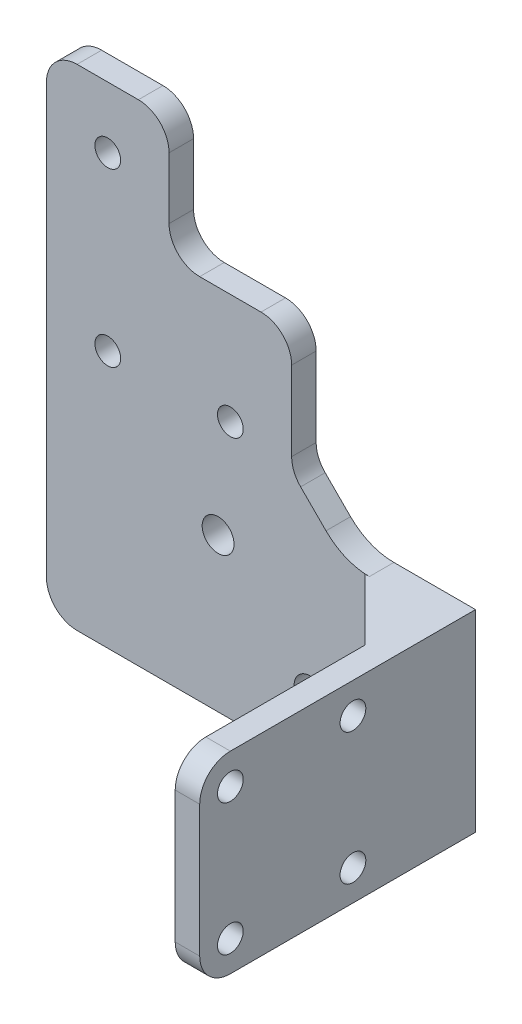
from build123d import *

# Parameters (mm, degrees)
MODEL_R         = 2.5999948
MODEL_R_2       = 2.0999958
EXTRUDE_1_DEPTH = 4
EXTRUDE_2_DEPTH = 4
FILLET_1_R      = 10
SKETCH_4_R      = 2.1
EXTRUDE_3_DEPTH = 4
EXTRUDE_4_DEPTH = 4


with BuildPart() as part:
    # Model → Бобышка-Вытянуть1 (new body)
    with BuildSketch(Plane.XY):
        with BuildLine():
            Line((308.392658055, 233.393719024), (308.392658055, 210.464832693))
            ThreePointArc((308.392658055, 210.464832693), (306.92819489, 206.929305859), (303.392668055, 205.464842693))
            Line((303.392668055, 205.464842693), (263.392748055, 205.464842693))
            ThreePointArc((263.392748055, 205.464842693), (259.85722122, 206.929305859), (258.392758055, 210.464832693))
            Line((258.392758055, 210.464832693), (258.392758055, 280.464692693))
            ThreePointArc((258.392758055, 280.464692693), (259.85722122, 284.000219528), (263.392748055, 285.464682693))
            Line((263.392748055, 285.464682693), (273.392728055, 285.464682693))
            ThreePointArc((273.392728055, 285.464682693), (276.92825489, 284.000219528), (278.392718055, 280.464692693))
            Line((278.392718055, 280.464692693), (278.392718055, 270.464712693))
            ThreePointArc((278.392718055, 270.464712693), (279.85718122, 266.929185859), (283.392708055, 265.464722693))
            Line((283.392708055, 265.464722693), (293.392688055, 265.464722693))
            ThreePointArc((293.392688055, 265.464722693), (296.92821489, 264.000259528), (298.392678055, 260.464732693))
            Line((298.392678055, 260.464732693), (298.392678055, 247.535826363))
            ThreePointArc((298.392678055, 247.535826363), (298.773279631, 245.622413028), (299.85714122, 244.000299528))
            Line((299.85714122, 244.000299528), (306.92819489, 236.929245859))
            ThreePointArc((306.92819489, 236.929245859), (308.012056479, 235.307132359), (308.392658055, 233.393719024))
        make_face()
        with Locations((286.392702055, 230.464792693)):
            Circle(MODEL_R, mode=Mode.SUBTRACT)
        with Locations((301.392672055, 215.464822693)):
            Circle(MODEL_R, mode=Mode.SUBTRACT)
        with Locations((268.392738055, 275.464702693)):
            Circle(MODEL_R_2, mode=Mode.SUBTRACT)
        with Locations((268.392738055, 247.464758693)):
            Circle(MODEL_R_2, mode=Mode.SUBTRACT)
        with Locations((288.392698055, 247.464758693)):
            Circle(MODEL_R_2, mode=Mode.SUBTRACT)
    extrude(amount=EXTRUDE_1_DEPTH)

    # Эскиз1 → Бобышка-Вытянуть2 (add)
    with BuildSketch(Plane(origin=(0, 0, 0), x_dir=(-1, 0, 0), z_dir=(0, 0, -1))):
        with BuildLine():
            Line((-308.392658055, 210.464832693), (-308.392658055, 232.615855145))
            Line((-308.392658055, 232.615855145), (-308.392658055, 233.393719024))
            ThreePointArc((-308.392658055, 233.393719024), (-308.012056479, 235.307132359), (-306.92819489, 236.929245859))
            Line((-306.92819489, 236.929245859), (-308.392658055, 236.929245859))
            Line((-308.392658055, 236.929245859), (-320.392658055, 236.929245859))
            Line((-320.392658055, 236.929245859), (-320.392658055, 205.464842693))
            Line((-320.392658055, 205.464842693), (-308.392658055, 205.464842693))
            Line((-308.392658055, 205.464842693), (-303.392668055, 205.464842693))
            ThreePointArc((-303.392668055, 205.464842693), (-306.92819489, 206.929305859), (-308.392658055, 210.464832693))
        make_face()
    extrude(amount=-EXTRUDE_2_DEPTH)

    # Скругление1
    fillet_1_edges = [part.edges().sort_by_distance(p)[0] for p in [
        (306.92819489, 236.929245859, 2),
    ]]
    fillet(fillet_1_edges, radius=FILLET_1_R)

    # Эскиз4 → Бобышка-Вытянуть3 (add)
    with BuildSketch(Plane(origin=(320.392658055, 0, 0), x_dir=(0, 0, -1), z_dir=(1, 0, 0))):
        with BuildLine():
            Line((0, 236.929245859), (-40, 236.929245859))
            ThreePointArc((-40, 236.929245859), (-43.535533906, 235.464779764), (-45, 231.929245859))
            Line((-45, 231.929245859), (-45, 210.464842693))
            ThreePointArc((-45, 210.464842693), (-43.535533906, 206.929308787), (-40, 205.464842693))
            Line((-40, 205.464842693), (0, 205.464842693))
            Line((0, 205.464842693), (0, 236.929245859))
        make_face()
        with Locations(Location((-40, 231.929245859, 0), (0, 0, 90))):
            Circle(SKETCH_4_R, mode=Mode.SUBTRACT)
        with Locations(Location((-40, 210.464842693, 0), (0, 0, 90))):
            Circle(SKETCH_4_R, mode=Mode.SUBTRACT)
        with Locations(Location((-20, 231.929245859, 0), (0, 0, 90))):
            Circle(SKETCH_4_R, mode=Mode.SUBTRACT)
        with Locations(Location((-20, 210.464842693, 0), (0, 0, 90))):
            Circle(SKETCH_4_R, mode=Mode.SUBTRACT)
    extrude(amount=EXTRUDE_3_DEPTH)

    # Эскиз5 → Бобышка-Вытянуть4 (add)
    with BuildSketch(Plane(origin=(0, 236.929245859, 0), x_dir=(1, 0, 0), z_dir=(0, 1, 0))):
        Polygon((320.392658055, -4), (310.392658055, -4), (320.392658055, -14), align=None)
    extrude_4 = extrude(amount=-EXTRUDE_4_DEPTH)

    # Зеркальное отражение1: Бобышка-Вытянуть4 across plane
    add(extrude_4.mirror(Plane.ZX.offset(221.197044276)))


solid = part.part
